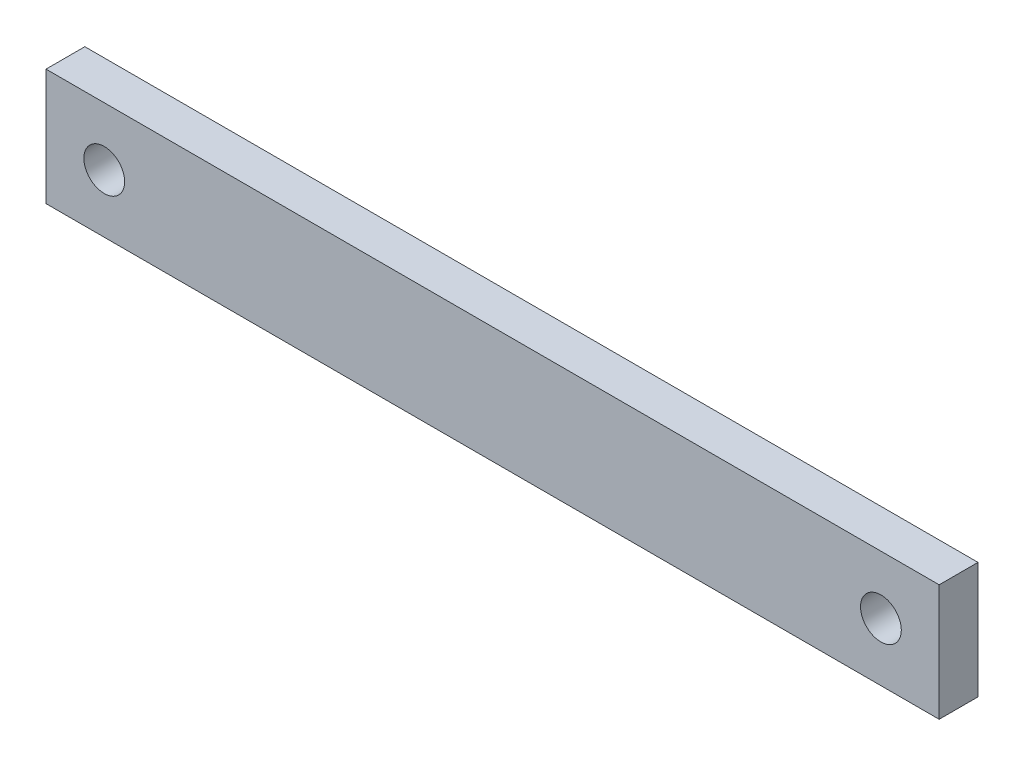
from build123d import *

# Parameters (mm, degrees)
SKETCH1_W      = 46
SKETCH1_H      = 6
SKETCH1_R      = 1.05
L40_LINK_DEPTH = 2


with BuildPart() as part:
    # Sketch1 → L40_Link (new body)
    with BuildSketch(Plane.XY):
        with Locations((20, 0)):
            Rectangle(SKETCH1_W, SKETCH1_H)
        Circle(SKETCH1_R, mode=Mode.SUBTRACT)
        with Locations((40, 0)):
            Circle(SKETCH1_R, mode=Mode.SUBTRACT)
    extrude(amount=L40_LINK_DEPTH)


solid = part.part
